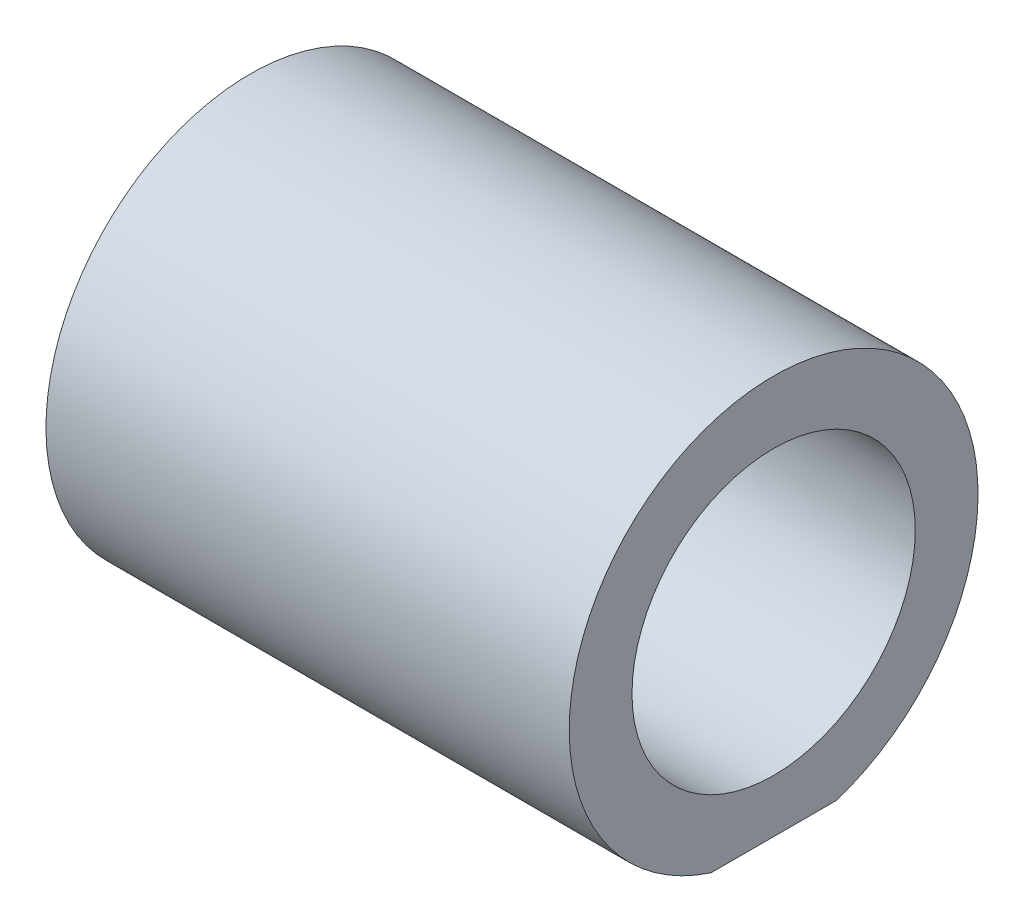
from build123d import *

# Parameters (mm, degrees)
SKETCH1_R           = 5.500000049
BOSS_EXTRUDE1_DEPTH = 20.32


with BuildPart() as part:
    # Sketch1 → Boss-Extrude1 (new body)
    with BuildSketch(Plane.YZ):
        with BuildLine():
            Line((-7.5565, -2.429653062), (-7.5565, 2.429653062))
            ThreePointArc((-7.5565, 2.429653062), (7.9375, 0), (-7.5565, -2.429653062))
        make_face()
        with Locations(Location((0, 0, 0), (0, 0, 270))):
            Circle(SKETCH1_R, mode=Mode.SUBTRACT)
    extrude(amount=BOSS_EXTRUDE1_DEPTH)


solid = part.part
